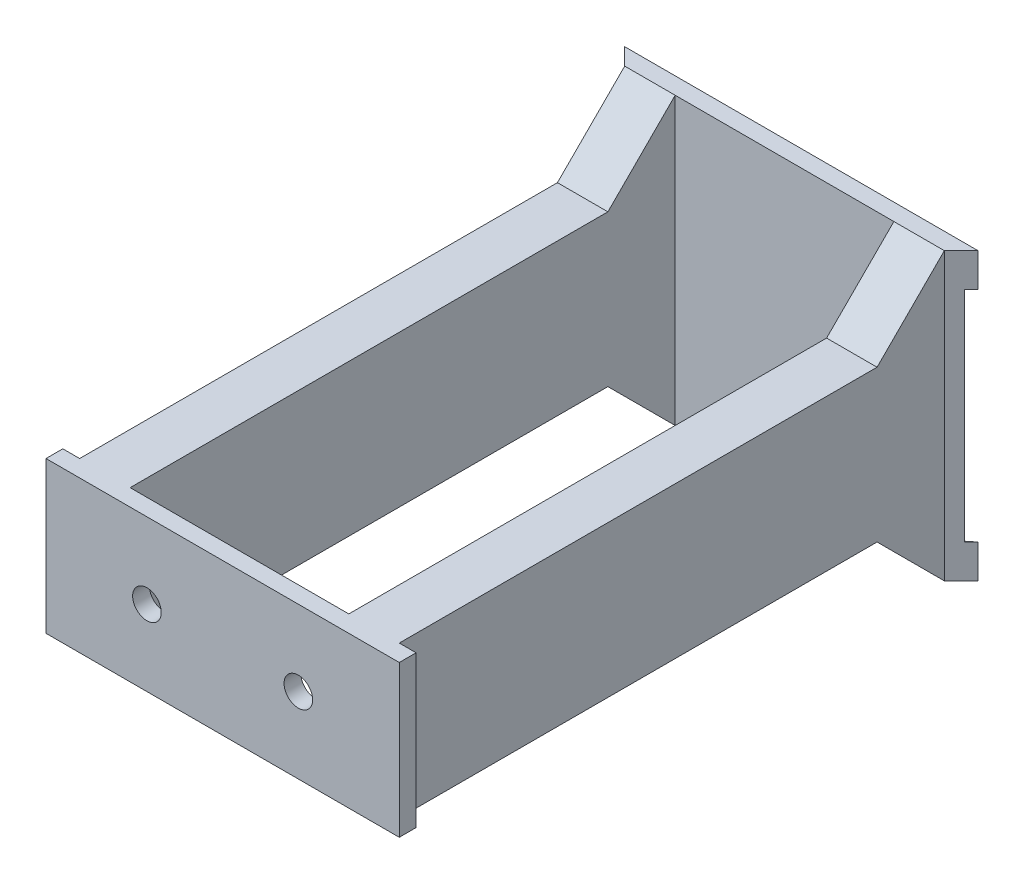
from build123d import *

# Parameters (mm, degrees)
SKETCH1_W           = 65
SKETCH1_H           = 162
BOSS_EXTRUDE1_DEPTH = 42.5
CUT_EXTRUDE1_DEPTH  = 206.949629764
SKETCH4_R           = 4.25
CUT_EXTRUDE2_DEPTH  = 5
SKETCH5_W           = 2
SKETCH5_H           = 65
CUT_EXTRUDE3_DEPTH  = 206.949629919


with BuildPart() as part:
    # Sketch1 → Boss-Extrude1 (new, symmetric)
    with BuildSketch(Plane(origin=(0, 0, 0), x_dir=(1, 0, 0), z_dir=(0, 1, 0))):
        Polygon((100, 5), (100, 167), (105, 172), (0, 172), (5, 167), (5, 5), (0, 5), (0, 0), (105, 0), (105, 5), align=None)
        with Locations((52.5, 86)):
            Rectangle(SKETCH1_W, SKETCH1_H, mode=Mode.SUBTRACT)
    extrude(amount=BOSS_EXTRUDE1_DEPTH, both=True)

    # Sketch2 → Cut-Extrude1 (cut, through all)
    with BuildSketch(Plane(origin=(0, 0, 0), x_dir=(0, 0, -1), z_dir=(1, 0, 0))):
        Polygon((0, 22.5), (147, 22.5), (167, 42.5), (0, 42.5), align=None)
    cut_extrude1 = extrude(amount=CUT_EXTRUDE1_DEPTH, mode=Mode.SUBTRACT)

    # Mirror1: Cut-Extrude1 across plane
    add(cut_extrude1.mirror(Plane.ZX), mode=Mode.SUBTRACT)

    # Sketch3 → section 0 of cut_loft1
    with BuildSketch(Plane(origin=(0, 0, -170), x_dir=(-1, 0, 0), z_dir=(0, 0, -1)), mode=Mode.PRIVATE) as cut_loft1_s0:
        with BuildLine():
            Line((-102.5, 40), (0, 40))
            Line((0, 40), (0, -40))
            Line((0, -40), (-102.5, -40))
            Line((-102.5, -40), (-102.5, 40))
        make_face()
    # loft up to a face of the part (cut_loft1)
    loft([cut_loft1_s0.sketch, part.faces().sort_by_distance((52.5, 0, -172))[0]], mode=Mode.SUBTRACT)

    # Sketch4 → Cut-Extrude2 (cut)
    with BuildSketch(Plane.XY):
        with Locations((30, 0)):
            Circle(SKETCH4_R)
        with Locations((75, 0)):
            Circle(SKETCH4_R)
    extrude(amount=-CUT_EXTRUDE2_DEPTH, mode=Mode.SUBTRACT)

    # Sketch5 → Cut-Extrude3 (cut, through all)
    with BuildSketch(Plane(origin=(0, 0, 0), x_dir=(0, 0, -1), z_dir=(1, 0, 0))):
        with Locations((171, 0)):
            Rectangle(SKETCH5_W, SKETCH5_H)
    extrude(amount=CUT_EXTRUDE3_DEPTH, mode=Mode.SUBTRACT)


solid = part.part
